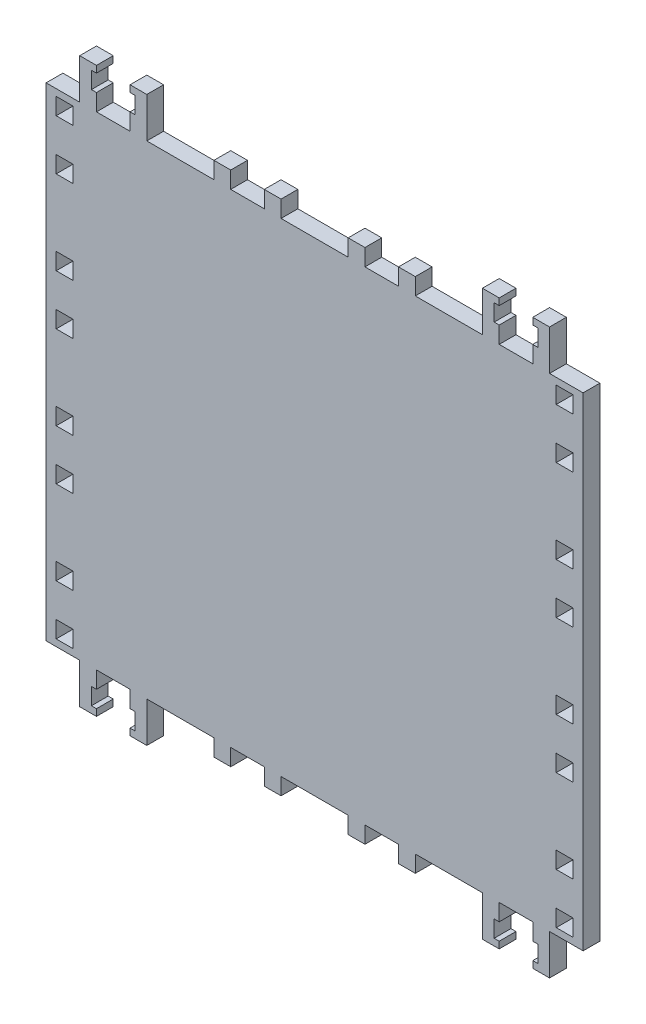
from build123d import *

# Parameters (mm, degrees)
ESQUISSE1_W        = 5
ESQUISSE1_H        = 5
BOSS_EXTRU_1_DEPTH = 5


with BuildPart() as part:
    # Esquisse1 → Boss.-Extru.1 (new body)
    with BuildSketch(Plane.XY):
        Polygon((-70, 144), (-80, 144), (-80, 0), (-70, 0), (-70, -5), (-70, -12), (-65, -12), (-65, -10), (-66.5, -10), (-66.5, -5), (-65, -5), (-65, 0), (-60, 0), (-55, 0), (-55, -5), (-53.5, -5), (-53.5, -10), (-55, -10), (-55, -12), (-50, -12), (-50, -5), (-50, 0), (-30, 0), (-30, -5), (-25, -5), (-25, 0), (-20, 0), (-15, 0), (-15, -5), (-10, -5), (-10, 0), (10, 0), (10, -5), (15, -5), (15, 0), (20, 0), (25, 0), (25, -5), (30, -5), (30, 0), (50, 0), (50, -5), (50, -12), (55, -12), (55, -10), (53.5, -10), (53.5, -5), (55, -5), (55, 0), (60, 0), (65, 0), (65, -5), (66.5, -5), (66.5, -10), (65, -10), (65, -12), (70, -12), (70, -5), (70, 0), (80, 0), (80, 144), (70, 144), (70, 149), (70, 156), (65, 156), (65, 154), (66.5, 154), (66.5, 149), (65, 149), (65, 144), (60, 144), (55, 144), (55, 149), (53.5, 149), (53.5, 154), (55, 154), (55, 156), (50, 156), (50, 149), (50, 144), (30, 144), (30, 149), (25, 149), (25, 144), (20, 144), (15, 144), (15, 149), (10, 149), (10, 144), (-10, 144), (-10, 149), (-15, 149), (-15, 144), (-20, 144), (-25, 144), (-25, 149), (-30, 149), (-30, 144), (-50, 144), (-50, 149), (-50, 156), (-55, 156), (-55, 154), (-53.5, 154), (-53.5, 149), (-55, 149), (-55, 144), (-60, 144), (-65, 144), (-65, 149), (-66.5, 149), (-66.5, 154), (-65, 154), (-65, 156), (-70, 156), (-70, 149), align=None)
        with Locations((-74.5, 4.5)):
            Rectangle(ESQUISSE1_W, ESQUISSE1_H, mode=Mode.SUBTRACT)
        with Locations((-74.5, 19.5)):
            Rectangle(ESQUISSE1_W, ESQUISSE1_H, mode=Mode.SUBTRACT)
        with Locations((-74.5, 44.5)):
            Rectangle(ESQUISSE1_W, ESQUISSE1_H, mode=Mode.SUBTRACT)
        with Locations((-74.5, 59.5)):
            Rectangle(ESQUISSE1_W, ESQUISSE1_H, mode=Mode.SUBTRACT)
        with Locations((74.5, 4.5)):
            Rectangle(ESQUISSE1_W, ESQUISSE1_H, mode=Mode.SUBTRACT)
        with Locations((74.5, 19.5)):
            Rectangle(ESQUISSE1_W, ESQUISSE1_H, mode=Mode.SUBTRACT)
        with Locations((74.5, 44.5)):
            Rectangle(ESQUISSE1_W, ESQUISSE1_H, mode=Mode.SUBTRACT)
        with Locations((74.5, 59.5)):
            Rectangle(ESQUISSE1_W, ESQUISSE1_H, mode=Mode.SUBTRACT)
        with Locations((-74.5, 84.5)):
            Rectangle(ESQUISSE1_W, ESQUISSE1_H, mode=Mode.SUBTRACT)
        with Locations((-74.5, 99.5)):
            Rectangle(ESQUISSE1_W, ESQUISSE1_H, mode=Mode.SUBTRACT)
        with Locations((-74.5, 124.5)):
            Rectangle(ESQUISSE1_W, ESQUISSE1_H, mode=Mode.SUBTRACT)
        with Locations((-74.5, 139.5)):
            Rectangle(ESQUISSE1_W, ESQUISSE1_H, mode=Mode.SUBTRACT)
        with Locations((74.5, 84.5)):
            Rectangle(ESQUISSE1_W, ESQUISSE1_H, mode=Mode.SUBTRACT)
        with Locations((74.5, 99.5)):
            Rectangle(ESQUISSE1_W, ESQUISSE1_H, mode=Mode.SUBTRACT)
        with Locations((74.5, 124.5)):
            Rectangle(ESQUISSE1_W, ESQUISSE1_H, mode=Mode.SUBTRACT)
        with Locations((74.5, 139.5)):
            Rectangle(ESQUISSE1_W, ESQUISSE1_H, mode=Mode.SUBTRACT)
    extrude(amount=BOSS_EXTRU_1_DEPTH)


solid = part.part
